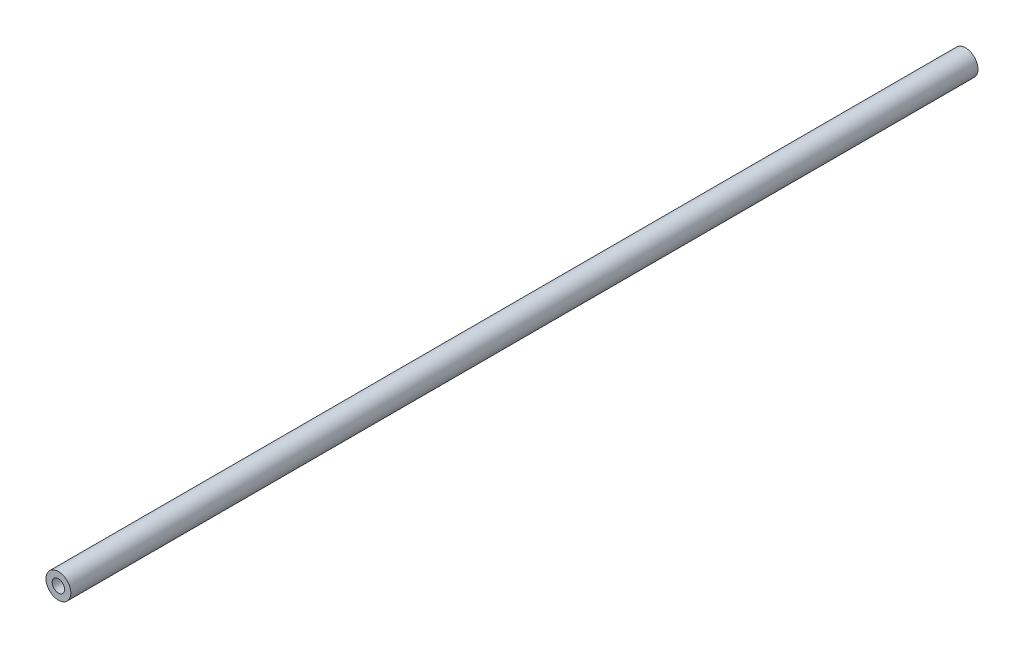
from build123d import *

# Parameters (mm, degrees)
SKETCH1_R           = 4
SKETCH1_R_2         = 2
BOSS_EXTRUDE1_DEPTH = 292


with BuildPart() as part:
    # Sketch1 → Boss-Extrude1 (new body)
    with BuildSketch(Plane.XY):
        Circle(SKETCH1_R)
        Circle(SKETCH1_R_2, mode=Mode.SUBTRACT)
    extrude(amount=BOSS_EXTRUDE1_DEPTH)


solid = part.part
